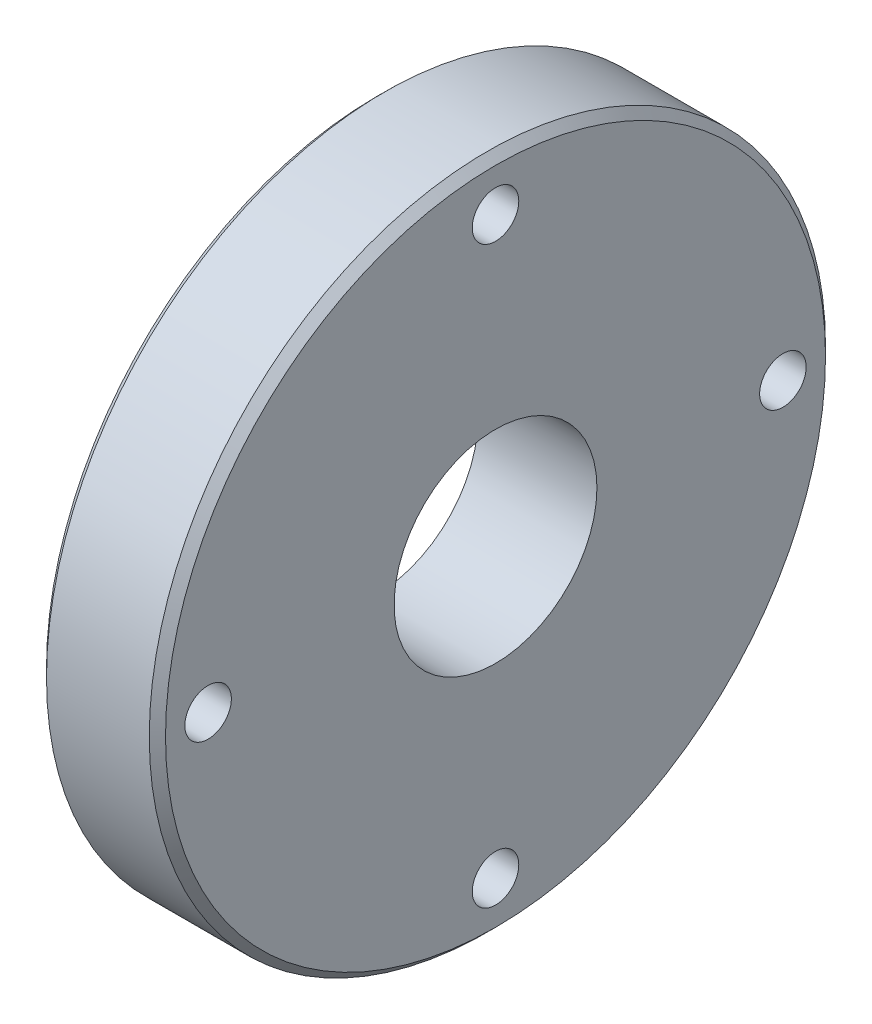
from build123d import *

# Parameters (mm, degrees)
SKETCH1_R           = 63.5
BOSS_EXTRUDE1_DEPTH = 22.352
SKETCH2_R           = 19.05
CUT_EXTRUDE2_DEPTH  = 93.542487021
SKETCH3_R           = 4.3688
CUT_EXTRUDE4_DEPTH  = 93.542487021
SKETCH4_R           = 6.7437
CUT_EXTRUDE5_DEPTH  = 9.652
CHAMFER1_SIZE       = 1.524


with BuildPart() as part:
    # Sketch1 → Boss-Extrude1 (new body)
    with BuildSketch(Plane.YZ):
        with Locations(Location((0, 0, 0), (0, 0, 270))):
            Circle(SKETCH1_R)
    extrude(amount=BOSS_EXTRUDE1_DEPTH)

    # Sketch2 → Cut-Extrude2 (cut, through all)
    with BuildSketch(Plane.YZ):
        with Locations(Location((0, 0, 0), (0, 0, 270))):
            Circle(SKETCH2_R)
    extrude(amount=CUT_EXTRUDE2_DEPTH, mode=Mode.SUBTRACT)

    # Sketch3 → Cut-Extrude4 (cut, through all)
    with BuildSketch(Plane.YZ):
        with Locations(Location((53.975, 0, 0), (0, 0, 270))):
            Circle(SKETCH3_R)
        with Locations(Location((0, 53.975, 0), (0, 0, 270))):
            Circle(SKETCH3_R)
        with Locations(Location((-53.975, 0, 0), (0, 0, 270))):
            Circle(SKETCH3_R)
        with Locations(Location((0, -53.975, 0), (0, 0, 270))):
            Circle(SKETCH3_R)
    extrude(amount=CUT_EXTRUDE4_DEPTH, mode=Mode.SUBTRACT)

    # Sketch4 → Cut-Extrude5 (cut)
    with BuildSketch(Plane.YZ):
        with Locations(Location((53.975, 0, 0), (0, 0, 270))):
            Circle(SKETCH4_R)
        with Locations(Location((0, 53.975, 0), (0, 0, 270))):
            Circle(SKETCH4_R)
        with Locations(Location((-53.975, 0, 0), (0, 0, 270))):
            Circle(SKETCH4_R)
        with Locations(Location((0, -53.975, 0), (0, 0, 270))):
            Circle(SKETCH4_R)
    extrude(amount=CUT_EXTRUDE5_DEPTH, mode=Mode.SUBTRACT)

    # Chamfer1
    chamfer1_edges = [part.edges().sort_by_distance(p)[0] for p in [
        (0, 0, 63.5),
        (22.352, 0, 63.5),
    ]]
    chamfer(chamfer1_edges, length=CHAMFER1_SIZE)


solid = part.part
